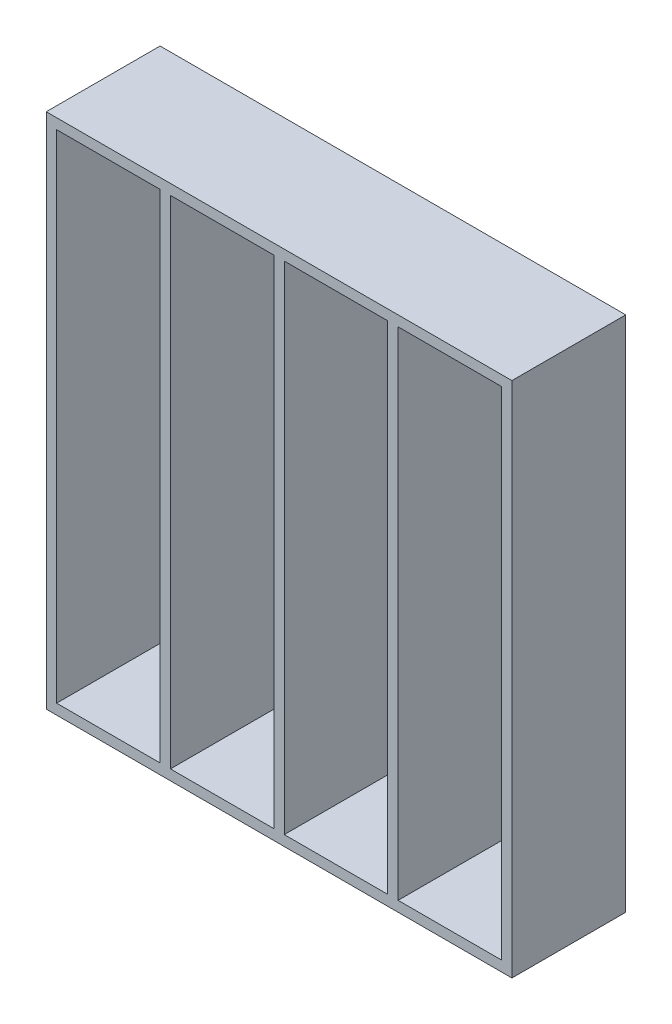
from build123d import *

# Parameters (mm, degrees)
ESQUISSE1_W             = 45
ESQUISSE1_H             = 50
EXTRUSION1_DEPTH        = 11
ESQUISSE2_W             = 10
ESQUISSE2_H             = 48
ENL_V_MAT_EXTRU_1_DEPTH = 10


with BuildPart() as part:
    # Esquisse1 → Extrusion1 (new body)
    with BuildSketch(Plane.XY):
        with Locations((-22.5, 25)):
            Rectangle(ESQUISSE1_W, ESQUISSE1_H)
    extrude(amount=EXTRUSION1_DEPTH)

    # Esquisse2 → Enlèv. mat.-Extru.1 (cut)
    with BuildSketch(Plane.XY.offset(11)):
        with Locations((-39, 25)):
            Rectangle(ESQUISSE2_W, ESQUISSE2_H)
        with Locations((-28, 25)):
            Rectangle(ESQUISSE2_W, ESQUISSE2_H)
        with Locations((-17, 25)):
            Rectangle(ESQUISSE2_W, ESQUISSE2_H)
        with Locations((-6, 25)):
            Rectangle(ESQUISSE2_W, ESQUISSE2_H)
    extrude(amount=-ENL_V_MAT_EXTRU_1_DEPTH, mode=Mode.SUBTRACT)


solid = part.part
